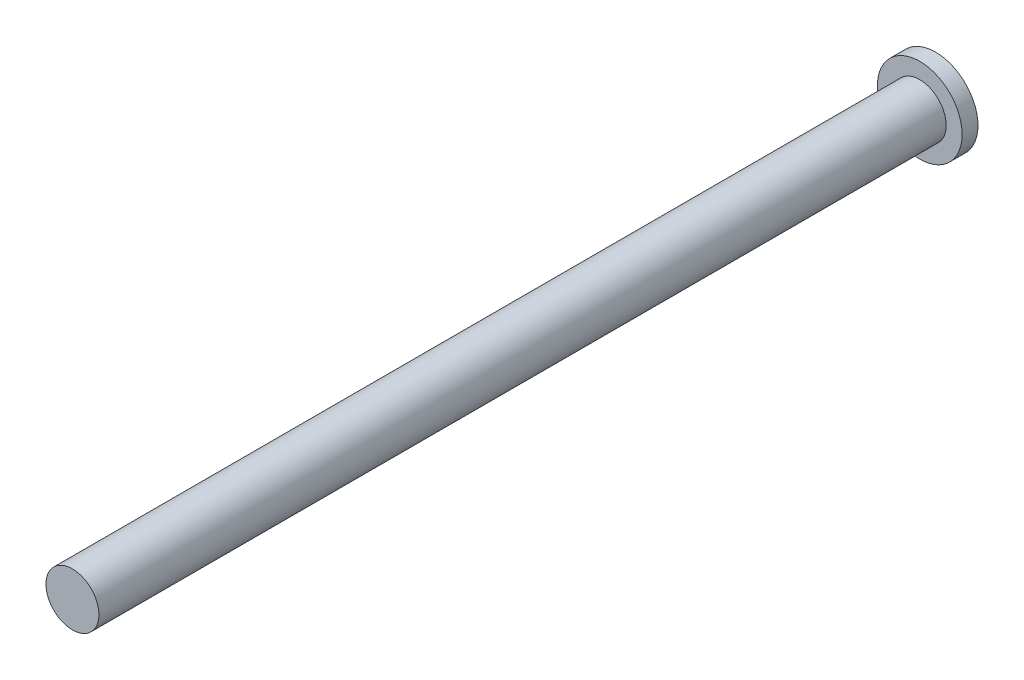
from build123d import *

# Parameters (mm, degrees)
SKETCH1_R           = 4
BOSS_EXTRUDE1_DEPTH = 1.5
SKETCH2_R           = 2.5
BOSS_EXTRUDE2_DEPTH = 80


with BuildPart() as part:
    # Sketch1 → Boss-Extrude1 (new body)
    with BuildSketch(Plane.XY):
        Circle(SKETCH1_R)
    extrude(amount=BOSS_EXTRUDE1_DEPTH)

    # Sketch2 → Boss-Extrude2 (add)
    with BuildSketch(Plane.XY.offset(1.5)):
        Circle(SKETCH2_R)
    extrude(amount=BOSS_EXTRUDE2_DEPTH)


solid = part.part
